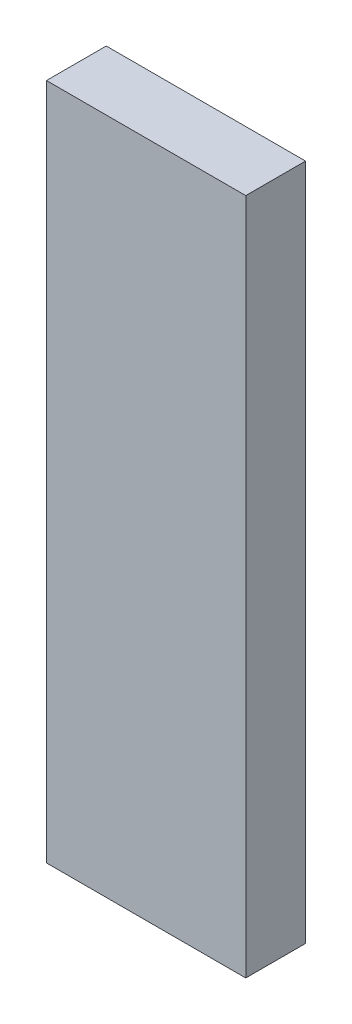
from build123d import *

# Parameters (mm, degrees)
SZKIC1_W                    = 50
SZKIC1_H                    = 15
DODANIE_WYCI_GNI_CIE1_DEPTH = 170


with BuildPart() as part:
    # Szkic1 → Dodanie-wyciągnięcie1 (new body)
    with BuildSketch(Plane(origin=(0, 0, 0), x_dir=(1, 0, 0), z_dir=(0, 1, 0))):
        Rectangle(SZKIC1_W, SZKIC1_H)
    extrude(amount=DODANIE_WYCI_GNI_CIE1_DEPTH)


solid = part.part
